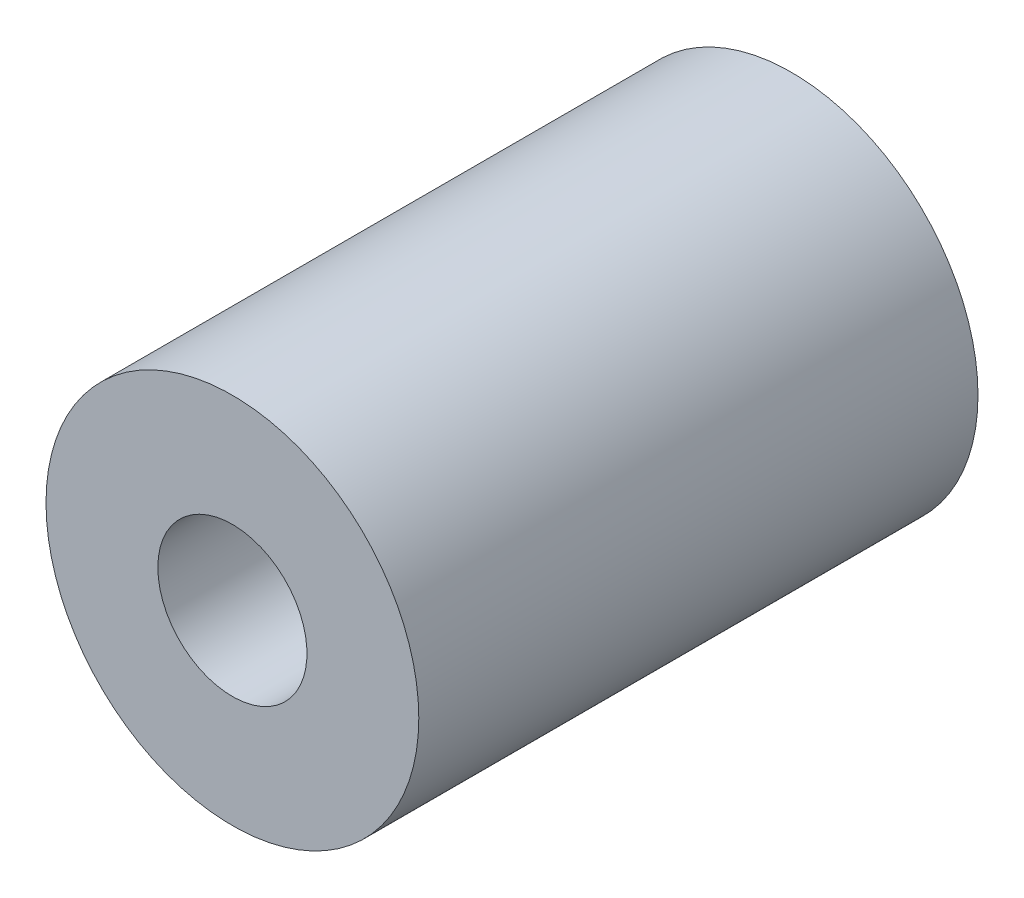
from build123d import *

# Parameters (mm, degrees)
SKETCH1_R           = 10
SKETCH1_R_2         = 4
BOSS_EXTRUDE1_DEPTH = 30


with BuildPart() as part:
    # Sketch1 → Boss-Extrude1 (new body)
    with BuildSketch(Plane.XY):
        with Locations(Location((0, 0, 0), (0, 0, 180))):
            Circle(SKETCH1_R)
        with Locations(Location((0, 0, 0), (0, 0, 180))):
            Circle(SKETCH1_R_2, mode=Mode.SUBTRACT)
    extrude(amount=BOSS_EXTRUDE1_DEPTH)


solid = part.part
